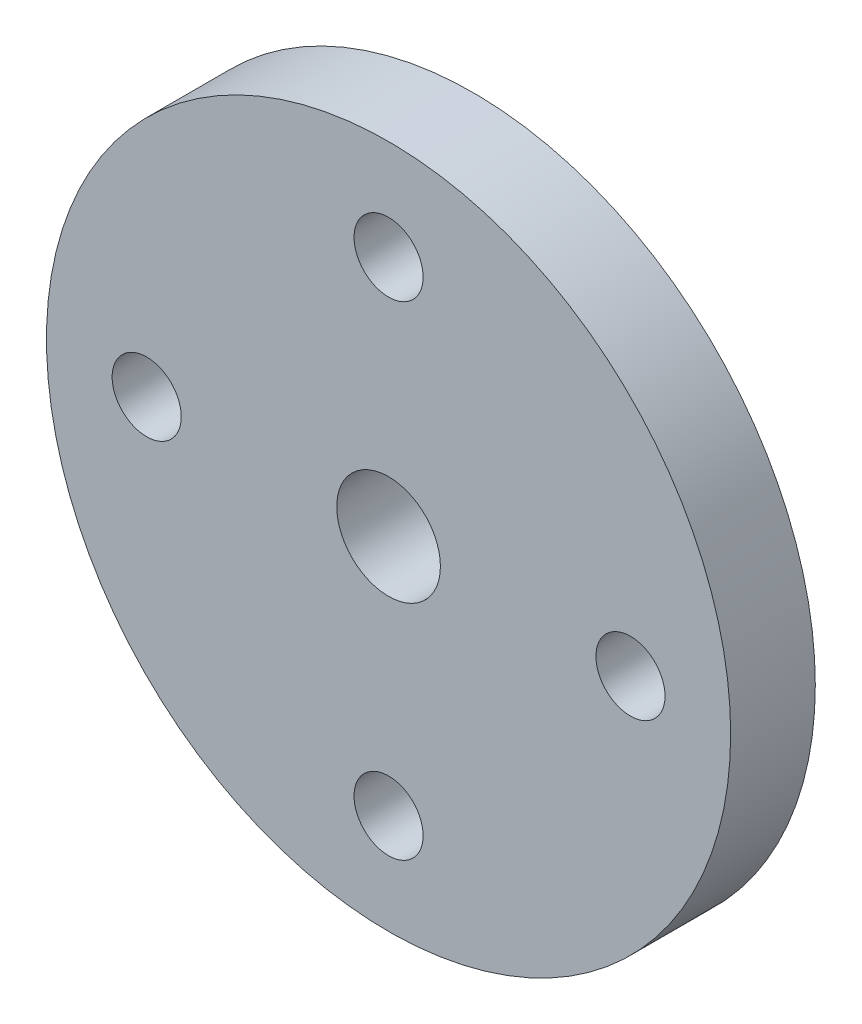
from build123d import *

# Parameters (mm, degrees)
CROQUIS1_R              = 9.9
SALIENTE_EXTRUIR1_DEPTH = 2.45
CROQUIS2_R              = 4.5
SALIENTE_EXTRUIR2_DEPTH = 4.5
CROQUIS3_R              = 1.5
CROQUIS3_R_2            = 1
CORTAR_EXTRUIR1_DEPTH   = 15.706121175


with BuildPart() as part:
    # Croquis1 → Saliente-Extruir1 (new body)
    with BuildSketch(Plane.XY):
        Circle(CROQUIS1_R)
    extrude(amount=SALIENTE_EXTRUIR1_DEPTH)

    # Croquis2 → Saliente-Extruir2 (add)
    with BuildSketch(Plane.XY.offset(2.45)):
        Circle(CROQUIS2_R)
    extrude(amount=-SALIENTE_EXTRUIR2_DEPTH)

    # Croquis3 → Cortar-Extruir1 (cut, through all)
    with BuildSketch(Plane.XY.offset(2.45)):
        Circle(CROQUIS3_R)
        with Locations((7, 0)):
            Circle(CROQUIS3_R_2)
        with Locations((0, -7)):
            Circle(CROQUIS3_R_2)
        with Locations((-7, 0)):
            Circle(CROQUIS3_R_2)
        with Locations((0, 7)):
            Circle(CROQUIS3_R_2)
    extrude(amount=-CORTAR_EXTRUIR1_DEPTH, mode=Mode.SUBTRACT)


solid = part.part
